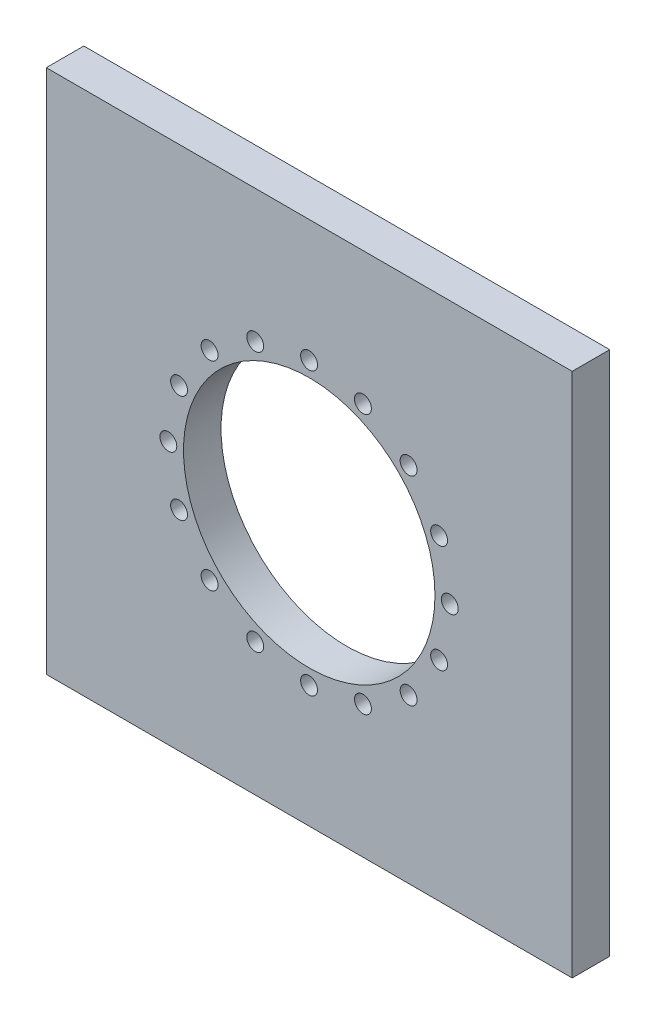
from build123d import *

# Parameters (mm, degrees)
SKETCH3_W             = 140.131000148
SKETCH3_H             = 140
BOSS_EXTRUDE3_DEPTH   = 10
SKETCH3_7_OUTSIDE_W   = 181.797
SKETCH3_7_OUTSIDE_H   = 181.666
SKETCH3_7_OUTSIDE_W_2 = 140.131000148
SKETCH3_7_OUTSIDE_H_2 = 140
SKETCH3_7_OUTSIDE_R   = 33.499999497
CUT_EXTRUDE5_DEPTH    = 10
SKETCH2_R             = 2.25
CUT_EXTRUDE6_DEPTH    = 10


with BuildPart() as part:
    # Sketch3 → Boss-Extrude3 (new body)
    with BuildSketch(Plane.XY):
        with Locations((-121.856065437, 0)):
            Rectangle(SKETCH3_W, SKETCH3_H)
    extrude(amount=BOSS_EXTRUDE3_DEPTH)

    # Sketch3<7> outside → Cut-Extrude5 (cut)
    # profile 1 of 2: a face of its own
    with BuildSketch(Plane.XY):
        with Locations((-121.8565, 0)):
            Rectangle(SKETCH3_7_OUTSIDE_W, SKETCH3_7_OUTSIDE_H)
        with Locations((-121.856065437, 0)):
            Rectangle(SKETCH3_7_OUTSIDE_W_2, SKETCH3_7_OUTSIDE_H_2, mode=Mode.SUBTRACT)
    # profile 2 of 2: a face of its own
    with BuildSketch(Plane.XY):
        with Locations((-121.856065437, 0)):
            Circle(SKETCH3_7_OUTSIDE_R)
    extrude(amount=CUT_EXTRUDE5_DEPTH, mode=Mode.SUBTRACT)

    # Sketch2 → Cut-Extrude6 (cut)
    with BuildSketch(Plane.XY):
        with Locations((-107.548664291, 34.645482469)):
            Circle(SKETCH2_R)
        with Locations((-95.38278871, 26.516504294)):
            Circle(SKETCH2_R)
        with Locations((-87.253810535, 14.350628714)):
            Circle(SKETCH2_R)
        with Locations((-84.399293004, 0)):
            Circle(SKETCH2_R)
        with Locations((-87.253810535, -14.350628714)):
            Circle(SKETCH2_R)
        with Locations((-95.38278871, -26.516504294)):
            Circle(SKETCH2_R)
        with Locations((-107.548664291, -34.645482469)):
            Circle(SKETCH2_R)
        with Locations((-121.899293004, -37.5)):
            Circle(SKETCH2_R)
        with Locations((-136.249921718, -34.645482469)):
            Circle(SKETCH2_R)
        with Locations((-148.415797299, -26.516504294)):
            Circle(SKETCH2_R)
        with Locations((-156.544775474, -14.350628714)):
            Circle(SKETCH2_R)
        with Locations((-159.399293004, 0)):
            Circle(SKETCH2_R)
        with Locations((-156.544775474, 14.350628714)):
            Circle(SKETCH2_R)
        with Locations((-148.415797299, 26.516504294)):
            Circle(SKETCH2_R)
        with Locations((-136.249921718, 34.645482469)):
            Circle(SKETCH2_R)
        with Locations((-121.899293004, 37.5)):
            Circle(SKETCH2_R)
    extrude(amount=CUT_EXTRUDE6_DEPTH, mode=Mode.SUBTRACT)


solid = part.part
